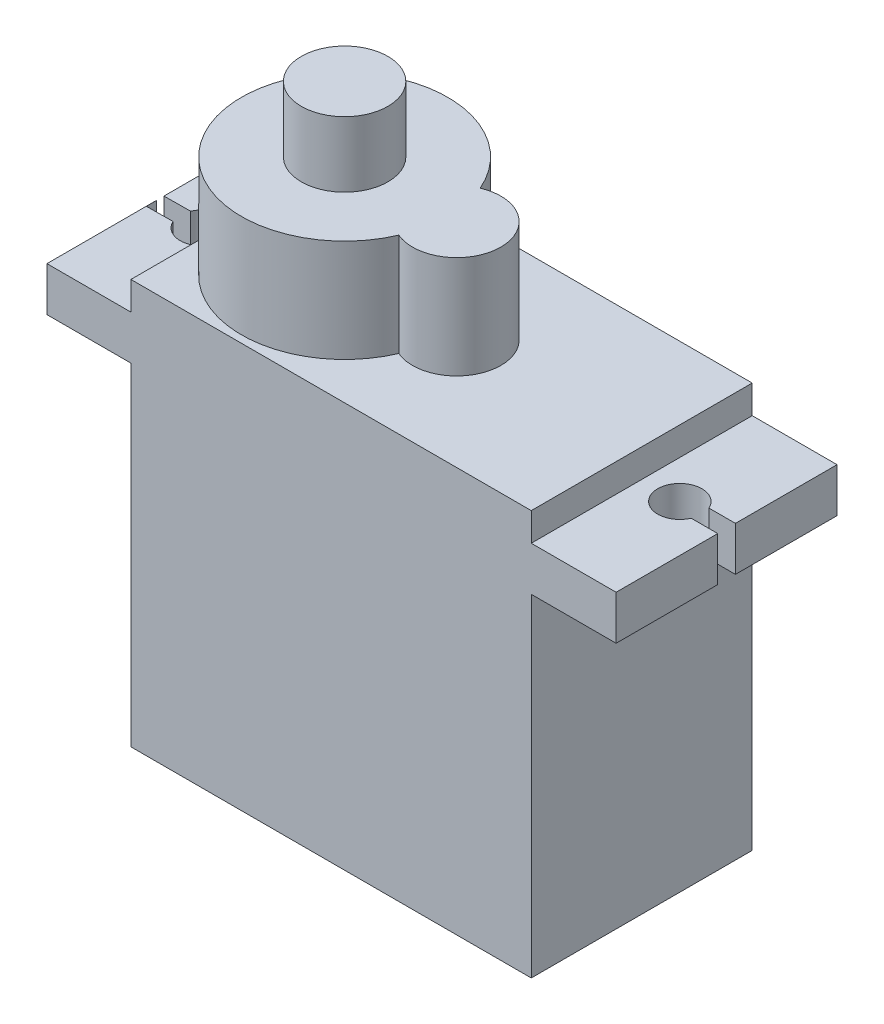
from build123d import *

# Parameters (mm, degrees)
SKETCH1_W                = 22.65
SKETCH1_H                = 12.5
BOSS_EXTRUDE1_DEPTH      = 22.9
SKETCH4_R                = 5.84
BOSS_EXTRUDE6_DEPTH      = 5.8
SKETCH12_R               = 2.45
BOSS_EXTRUDE7_DEPTH      = 3.7
SKETCH13_R               = 2.5
BOSS_EXTRUDE8_DEPTH      = 5.8
BOSS_EXTRUDE9_DEPTH      = 4.8
BOSS_EXTRUDE9_DEPTH_BACK = 27.4
SKETCH16_W               = 12.5
SKETCH16_H               = 2.5
CUT_EXTRUDE2_DEPTH       = 4.1
SKETCH18_R               = 0.6
BOSS_EXTRUDE14_DEPTH     = 1.5
BOSS_EXTRUDE14_2_DEPTH   = 1.5
BOSS_EXTRUDE14_3_DEPTH   = 1.5


with BuildPart() as part:
    # Sketch1 → Boss-Extrude1 (new body)
    with BuildSketch(Plane(origin=(0, 0, 0), x_dir=(1, 0, 0), z_dir=(0, 1, 0))):
        with Locations((-34.870532414, -1.006861806)):
            Rectangle(SKETCH1_W, SKETCH1_H)
    extrude(amount=BOSS_EXTRUDE1_DEPTH)

    # Sketch4 → Boss-Extrude6 (add)
    with BuildSketch(Plane(origin=(0, 22.9, 0), x_dir=(-1, 0, 0), z_dir=(0, 1, 0))):
        with Locations((40.355532414, 1.006861806)):
            Circle(SKETCH4_R)
    extrude(amount=BOSS_EXTRUDE6_DEPTH)

    # Sketch12 → Boss-Extrude7 (add)
    with BuildSketch(Plane(origin=(0, 28.7, 0), x_dir=(-1, 0, 0), z_dir=(0, 1, 0))):
        with Locations(Location((40.355532414, 1.006861806, 0), (0, 0, 90))):
            Circle(SKETCH12_R)
    extrude(amount=BOSS_EXTRUDE7_DEPTH)

    # Sketch13 → Boss-Extrude8 (add)
    with BuildSketch(Plane(origin=(0, 22.9, 0), x_dir=(-1, 0, 0), z_dir=(0, 1, 0))):
        with Locations((34.015532414, 1.006861806)):
            Circle(SKETCH13_R)
    extrude(amount=BOSS_EXTRUDE8_DEPTH)

    # Sketch16 → Boss-Extrude9 (add, two sides: drawn at the far end of the back side and taken through both)
    with BuildSketch(Plane(origin=(-23.545532414, 0, 0), x_dir=(0, 0, -1), z_dir=(1, 0, 0)).offset(-BOSS_EXTRUDE9_DEPTH_BACK)):
        with Locations((-1.006861806, 20.05)):
            Rectangle(SKETCH16_W, SKETCH16_H)
    extrude(amount=BOSS_EXTRUDE9_DEPTH + BOSS_EXTRUDE9_DEPTH_BACK)

    # Sketch17 → Cut-Extrude2 (cut)
    with BuildSketch(Plane(origin=(-23.545532414, 22.9, -5.243138194), x_dir=(1, 0, 0), z_dir=(0, -1, 0))):
        with BuildLine():
            Line((4.8, 5.75), (3.3, 5.75))
            ThreePointArc((3.3, 5.75), (0.904356076, 6.25), (3.3, 6.75))
            Line((3.3, 6.75), (4.8, 6.75))
            Line((4.8, 6.75), (4.8, 5.75))
        make_face()
        with BuildLine():
            Line((-27.395484872, 6.878781939), (-25.895532871, 6.866782131))
            ThreePointArc((-25.895532871, 6.866782131), (-23.503965543, 6.347633286), (-25.903532743, 5.866814131))
            Line((-25.903532743, 5.866814131), (-27.403484744, 5.878813939))
            Line((-27.403484744, 5.878813939), (-27.395484872, 6.878781939))
        make_face()
    extrude(amount=CUT_EXTRUDE2_DEPTH, mode=Mode.SUBTRACT)


with BuildPart() as body_2:
    # Sketch18 → Boss-Extrude14 (new body)
    with BuildSketch(Plane.ZY.offset(46.195532414)):
        with Locations((-0.193138194, 5.15)):
            Circle(SKETCH18_R)
    extrude(amount=BOSS_EXTRUDE14_DEPTH)


with BuildPart() as body_3:
    # Sketch18 → Boss-Extrude14 2 (new body)
    with BuildSketch(Plane.ZY.offset(46.195532414)):
        with Locations((1.006861806, 5.15)):
            Circle(SKETCH18_R)
    extrude(amount=BOSS_EXTRUDE14_2_DEPTH)


with BuildPart() as body_4:
    # Sketch18 → Boss-Extrude14 3 (new body)
    with BuildSketch(Plane.ZY.offset(46.195532414)):
        with Locations((2.206861806, 5.15)):
            Circle(SKETCH18_R)
    extrude(amount=BOSS_EXTRUDE14_3_DEPTH)


solid = Compound([part.part, body_2.part, body_3.part, body_4.part])
